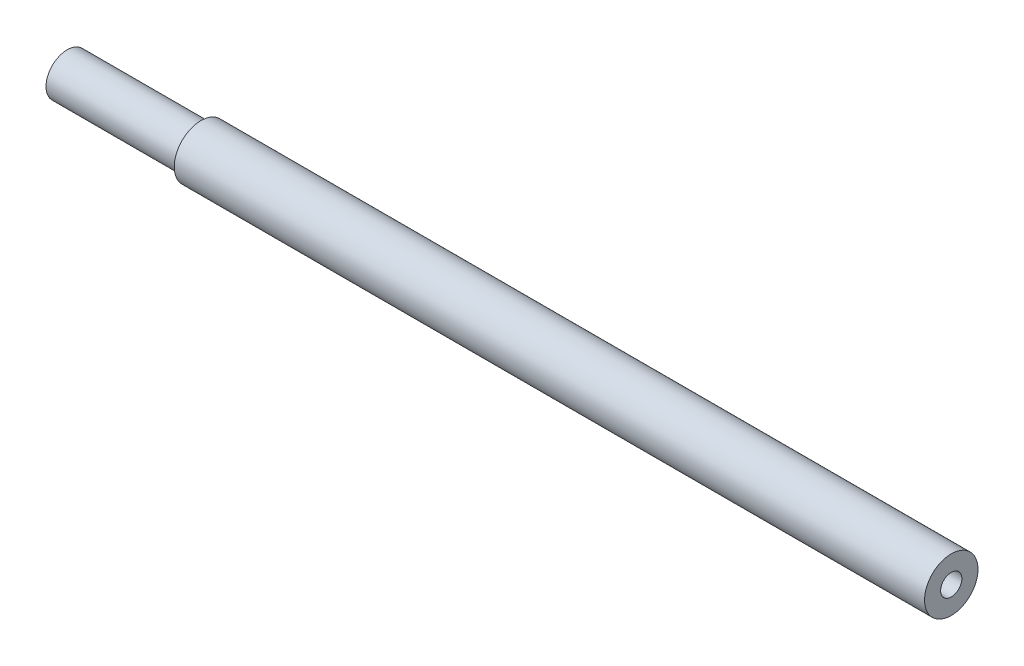
from build123d import *

# Parameters (mm, degrees)
SKETCH1_R           = 2
BOSS_EXTRUDE1_DEPTH = 28.055
SKETCH2_R           = 0.795
CUT_EXTRUDE1_DEPTH  = 7
SKETCH3_R           = 1.5875
BOSS_EXTRUDE2_DEPTH = 10


with BuildPart() as part:
    # Sketch1 → Boss-Extrude1 (new, symmetric)
    with BuildSketch(Plane(origin=(0, 0, 0), x_dir=(0, 0, -1), z_dir=(1, 0, 0))):
        Circle(SKETCH1_R)
    extrude(amount=BOSS_EXTRUDE1_DEPTH, both=True)

    # Sketch2 → Cut-Extrude1 (cut)
    with BuildSketch(Plane(origin=(28.055, 0, 0), x_dir=(0, 0, -1), z_dir=(1, 0, 0))):
        Circle(SKETCH2_R)
    extrude(amount=-CUT_EXTRUDE1_DEPTH, mode=Mode.SUBTRACT)

    # Sketch3 → Boss-Extrude2 (add)
    with BuildSketch(Plane.ZY.offset(28.055)):
        with Locations(Location((0, 0, 0), (0, 0, 180))):
            Circle(SKETCH3_R)
    extrude(amount=BOSS_EXTRUDE2_DEPTH)


solid = part.part
